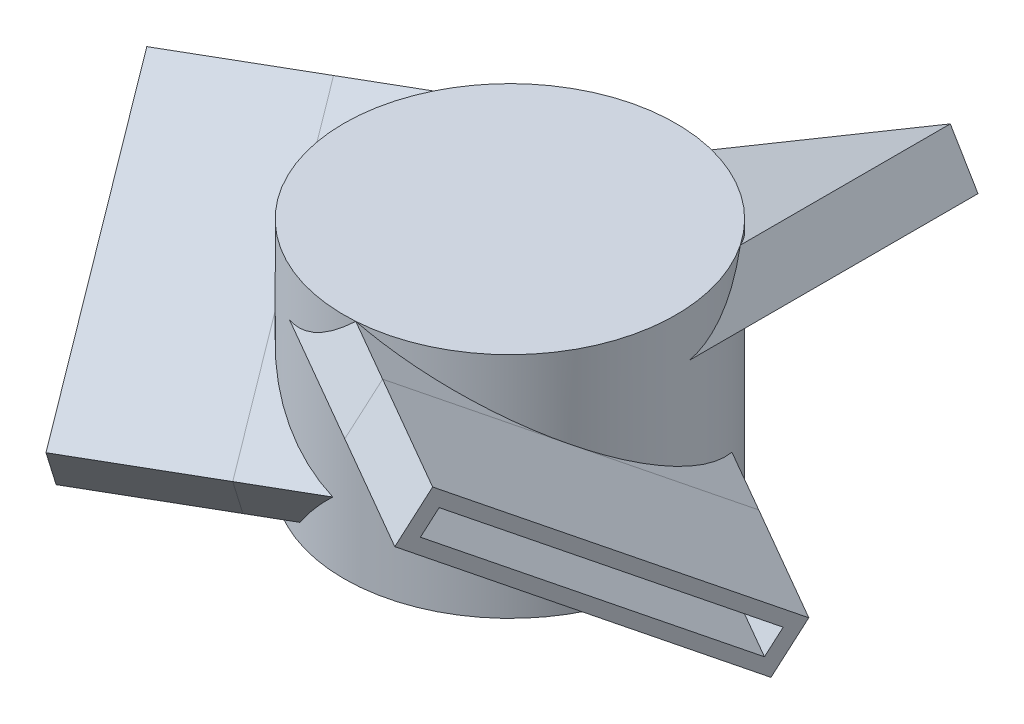
from build123d import *

# Parameters (mm, degrees)
EXTRUDE_THIN1_DEPTH      = 70
BOSS_EXTRUDE2_DEPTH      = 46.941755
BOSS_EXTRUDE2_DEPTH_BACK = 70
SKETCH3_R                = 85
CIRPATTERN1_COUNT        = 3
BOSS_EXTRUDE6_DEPTH      = 85
CIRPATTERN5_COUNT        = 3


with BuildPart() as part:
    # Sketch2 → Extrude-Thin1 (new body)
    with BuildSketch(Plane.XY):
        Polygon((-2.582492676, -36.836502593), (138.404044327, 46.941754633), (152.582492676, 23.081502593), (11.595955673, -60.696754633), align=None)
        Polygon((7.01112659, -39.278319413), (135.962227507, 37.348135367), (142.98887341, 25.523319413), (14.037772493, -51.103135367), align=None, mode=Mode.SUBTRACT)
    extrude(amount=EXTRUDE_THIN1_DEPTH)


with BuildPart() as body_2:
    # Sketch3 → Boss-Extrude2 (new, two sides: drawn at the far end of the back side and taken through both)
    with BuildSketch(Plane(origin=(8.336479099, 0, 0), x_dir=(1, 0, 0), z_dir=(0, 1, 0)).offset(-BOSS_EXTRUDE2_DEPTH_BACK)):
        with Locations(Location((59.574296727, -155, 0), (0, 0, 90))):
            Circle(SKETCH3_R)
    extrude(amount=BOSS_EXTRUDE2_DEPTH + BOSS_EXTRUDE2_DEPTH_BACK)


with BuildPart() as cirpattern1_1:
    # CirPattern1: pattern copy
    add(part.part.rotate(Axis((67.910775825, 0, 155), (0, 1, 0)), 1 * 360 / CIRPATTERN1_COUNT))


with BuildPart() as cirpattern1_2:
    # CirPattern1: pattern copy
    add(part.part.rotate(Axis((67.910775825, 0, 155), (0, 1, 0)), 2 * 360 / CIRPATTERN1_COUNT))


with BuildPart() as part_1:
    add(part.part)

    add(body_2.part)  # Boss-Extrude6 merges body 2
    # Sketch8 → Boss-Extrude6 (add)
    with BuildSketch(Plane.XY.offset(70)):
        Polygon((11.595955673, -60.696754633), (-2.582492676, -36.836502593), (138.404044327, 46.941754633), (152.582492676, 23.081502593), align=None)
    boss_extrude6 = extrude(amount=BOSS_EXTRUDE6_DEPTH)

    # CirPattern5: Boss-Extrude6 ×3 about axis
    cirpattern5_axis = Axis((67.910775825, 0, 155), (0, 1, 0))
    for i in range(1, CIRPATTERN5_COUNT):
        add(boss_extrude6.rotate(cirpattern5_axis, i * 360 / CIRPATTERN5_COUNT))


solid = Compound([cirpattern1_1.part, cirpattern1_2.part, part_1.part])
